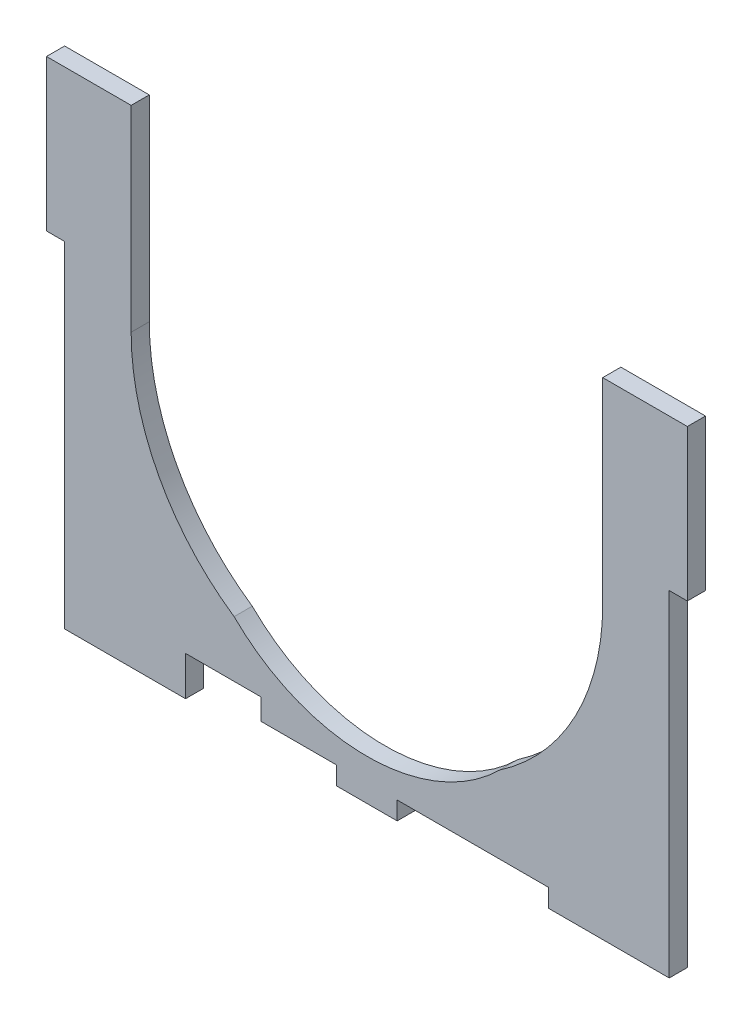
from build123d import *

# Parameters (mm, degrees)
BOSS_EXTRUDE1_DEPTH = 6
SKETCH3_W           = 6
SKETCH3_H           = 50
BOSS_EXTRUDE2_DEPTH = 6
LPATTERN1_COUNT     = 2
LPATTERN1_PITCH     = 206
SKETCH4_W           = 40
SKETCH4_H           = 6
SKETCH4_W_2         = 20
BOSS_EXTRUDE3_DEPTH = 6
SKETCH5_W           = 25
SKETCH5_H           = 7
CUT_EXTRUDE1_DEPTH  = 10


with BuildPart() as part:
    # Sketch1 → Boss-Extrude1 (new body)
    with BuildSketch(Plane.XY):
        with BuildLine():
            Line((-178, 90), (-178, 155))
            Line((-178, 155), (-200, 155))
            Line((-200, 155), (-200, 0))
            Line((-200, 0), (0, 0))
            Line((0, 0), (0, 155))
            Line((0, 155), (-22, 155))
            Line((-22, 155), (-22, 90))
            ThreePointArc((-22, 90), (-31.037807258, 53.555302549), (-56.056819802, 25.55625))
            ThreePointArc((-56.056819802, 25.55625), (-100, 7.5), (-143.943180198, 25.55625))
            ThreePointArc((-143.943180198, 25.55625), (-168.962192742, 53.555302549), (-178, 90))
        make_face()
    extrude(amount=BOSS_EXTRUDE1_DEPTH)

    # Sketch3 → Boss-Extrude2 (add)
    with BuildSketch(Plane.XY.offset(6)):
        with Locations((-203, 130)):
            Rectangle(SKETCH3_W, SKETCH3_H)
    boss_extrude2 = extrude(amount=-BOSS_EXTRUDE2_DEPTH)

    # LPattern1: Boss-Extrude2 ×2
    with Locations(*[(i * LPATTERN1_PITCH, 0, 0) for i in range(1, LPATTERN1_COUNT)]):
        add(boss_extrude2)

    # Sketch4 → Boss-Extrude3 (add)
    with BuildSketch(Plane.XY.offset(6)):
        with Locations((-180, -3)):
            Rectangle(SKETCH4_W, SKETCH4_H)
        with Locations((-100, -3)):
            Rectangle(SKETCH4_W_2, SKETCH4_H)
        with Locations((-20, -3)):
            Rectangle(SKETCH4_W, SKETCH4_H)
    extrude(amount=-BOSS_EXTRUDE3_DEPTH)

    # Sketch5 → Cut-Extrude1 (cut)
    with BuildSketch(Plane.XY.offset(6)):
        with Locations((-147.5, 3.5)):
            Rectangle(SKETCH5_W, SKETCH5_H)
    extrude(amount=-CUT_EXTRUDE1_DEPTH, mode=Mode.SUBTRACT)


solid = part.part
